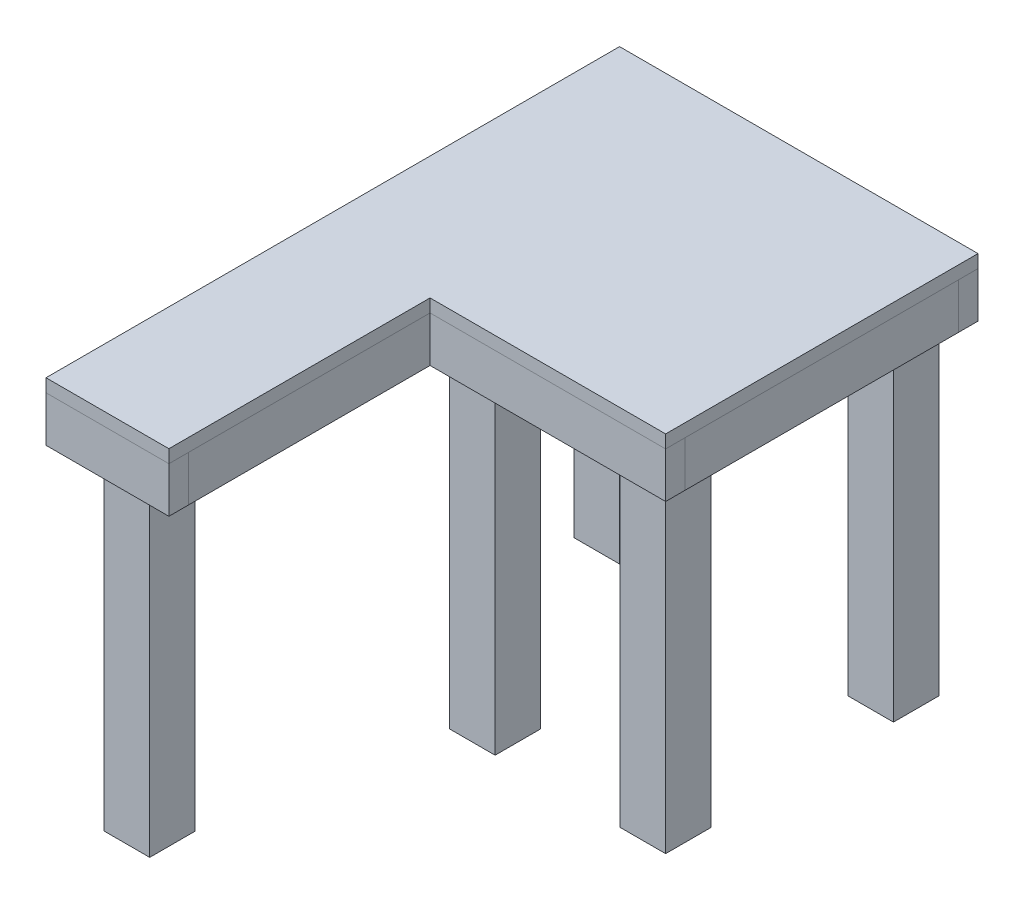
from build123d import *

# Parameters (mm, degrees)
BOSS_EXTRUDE1_DEPTH   = 25.4
SKETCH1_3_W           = 88.9
SKETCH1_3_H           = 88.9
BOSS_EXTRUDE2_DEPTH   = 722.6
BOSS_EXTRUDE2_2_DEPTH = 722.6
BOSS_EXTRUDE2_3_DEPTH = 722.6
BOSS_EXTRUDE2_4_DEPTH = 722.6
BOSS_EXTRUDE2_5_DEPTH = 722.6
BOSS_EXTRUDE3_DEPTH   = 88.9
BOSS_EXTRUDE4_DEPTH   = 88.9
BOSS_EXTRUDE6_DEPTH   = 88.9
BOSS_EXTRUDE7_DEPTH   = 88.9
BOSS_EXTRUDE8_DEPTH   = 88.9
BOSS_EXTRUDE9_DEPTH   = 88.9


with BuildPart() as part:
    # Sketch1 → Boss-Extrude1 (new body)
    with BuildSketch(Plane(origin=(0, 0, 0), x_dir=(1, 0, 0), z_dir=(0, 1, 0))):
        Polygon((-700, -510), (-460, -510), (-460, 0), (0, 0), (0, 610), (-700, 610), align=None)
    extrude(amount=BOSS_EXTRUDE1_DEPTH)


with BuildPart() as body_2:
    # Sketch1<3> → Boss-Extrude2 (new body)
    with BuildSketch(Plane(origin=(0, 0, 0), x_dir=(1, 0, 0), z_dir=(0, 1, 0))):
        with Locations((-580, -427.45)):
            Rectangle(SKETCH1_3_W, SKETCH1_3_H)
    extrude(amount=-BOSS_EXTRUDE2_DEPTH)


with BuildPart() as body_3:
    # Sketch1<3> → Boss-Extrude2 2 (new body)
    with BuildSketch(Plane(origin=(0, 0, 0), x_dir=(1, 0, 0), z_dir=(0, 1, 0))):
        with Locations((-415.55, 82.55)):
            Rectangle(SKETCH1_3_W, SKETCH1_3_H)
    extrude(amount=-BOSS_EXTRUDE2_2_DEPTH)


with BuildPart() as body_4:
    # Sketch1<3> → Boss-Extrude2 3 (new body)
    with BuildSketch(Plane(origin=(0, 0, 0), x_dir=(1, 0, 0), z_dir=(0, 1, 0))):
        with Locations((-82.55, 82.55)):
            Rectangle(SKETCH1_3_W, SKETCH1_3_H)
    extrude(amount=-BOSS_EXTRUDE2_3_DEPTH)


with BuildPart() as body_5:
    # Sketch1<3> → Boss-Extrude2 4 (new body)
    with BuildSketch(Plane(origin=(0, 0, 0), x_dir=(1, 0, 0), z_dir=(0, 1, 0))):
        with Locations((-82.55, 527.45)):
            Rectangle(SKETCH1_3_W, SKETCH1_3_H)
    extrude(amount=-BOSS_EXTRUDE2_4_DEPTH)


with BuildPart() as body_6:
    # Sketch1<3> → Boss-Extrude2 5 (new body)
    with BuildSketch(Plane(origin=(0, 0, 0), x_dir=(1, 0, 0), z_dir=(0, 1, 0))):
        with Locations((-617.45, 527.45)):
            Rectangle(SKETCH1_3_W, SKETCH1_3_H)
    extrude(amount=-BOSS_EXTRUDE2_5_DEPTH)


with BuildPart() as body_7:
    # Sketch1<4> → Boss-Extrude3 (new body)
    with BuildSketch(Plane(origin=(0, 0, 0), x_dir=(1, 0, 0), z_dir=(0, 1, 0))):
        Polygon((-460, 38.1), (-460, 0), (0, 0), (0, 38.1), (-38.1, 38.1), (-127, 38.1), (-371.1, 38.1), align=None)
    extrude(amount=-BOSS_EXTRUDE3_DEPTH)


with BuildPart() as body_8:
    # Sketch1<5> → Boss-Extrude4 (new body)
    with BuildSketch(Plane(origin=(0, 0, 0), x_dir=(1, 0, 0), z_dir=(0, 1, 0))):
        Polygon((-498.1, -471.9), (-460, -471.9), (-460, 0), (-460, 38.1), (-498.1, 38.1), align=None)
    extrude(amount=-BOSS_EXTRUDE4_DEPTH)


with BuildPart() as body_9:
    # Sketch1<6> → Boss-Extrude6 (new body)
    with BuildSketch(Plane(origin=(0, 0, 0), x_dir=(1, 0, 0), z_dir=(0, 1, 0))):
        Polygon((-700, -471.9), (-700, -510), (-460, -510), (-460, -471.9), (-498.1, -471.9), (-535.55, -471.9), (-624.45, -471.9), (-661.9, -471.9), align=None)
    extrude(amount=-BOSS_EXTRUDE6_DEPTH)


with BuildPart() as body_10:
    # Sketch1<7> → Boss-Extrude7 (new body)
    with BuildSketch(Plane(origin=(0, 0, 0), x_dir=(1, 0, 0), z_dir=(0, 1, 0))):
        Polygon((-700, 610), (-700, -471.9), (-661.9, -471.9), (-661.9, 483), (-661.9, 571.9), (-661.9, 610), align=None)
    extrude(amount=-BOSS_EXTRUDE7_DEPTH)


with BuildPart() as body_11:
    # Sketch1<8> → Boss-Extrude8 (new body)
    with BuildSketch(Plane(origin=(0, 0, 0), x_dir=(1, 0, 0), z_dir=(0, 1, 0))):
        Polygon((0, 610), (-661.9, 610), (-661.9, 571.9), (-573, 571.9), (-127, 571.9), (-38.1, 571.9), (0, 571.9), align=None)
    extrude(amount=-BOSS_EXTRUDE8_DEPTH)


with BuildPart() as body_12:
    # Sketch1<9> → Boss-Extrude9 (new body)
    with BuildSketch(Plane(origin=(0, 0, 0), x_dir=(1, 0, 0), z_dir=(0, 1, 0))):
        Polygon((-38.1, 38.1), (0, 38.1), (0, 571.9), (-38.1, 571.9), (-38.1, 483), (-38.1, 127), align=None)
    extrude(amount=-BOSS_EXTRUDE9_DEPTH)


solid = Compound([part.part, body_2.part, body_3.part, body_4.part, body_5.part, body_6.part, body_7.part, body_8.part, body_9.part, body_10.part, body_11.part, body_12.part])
